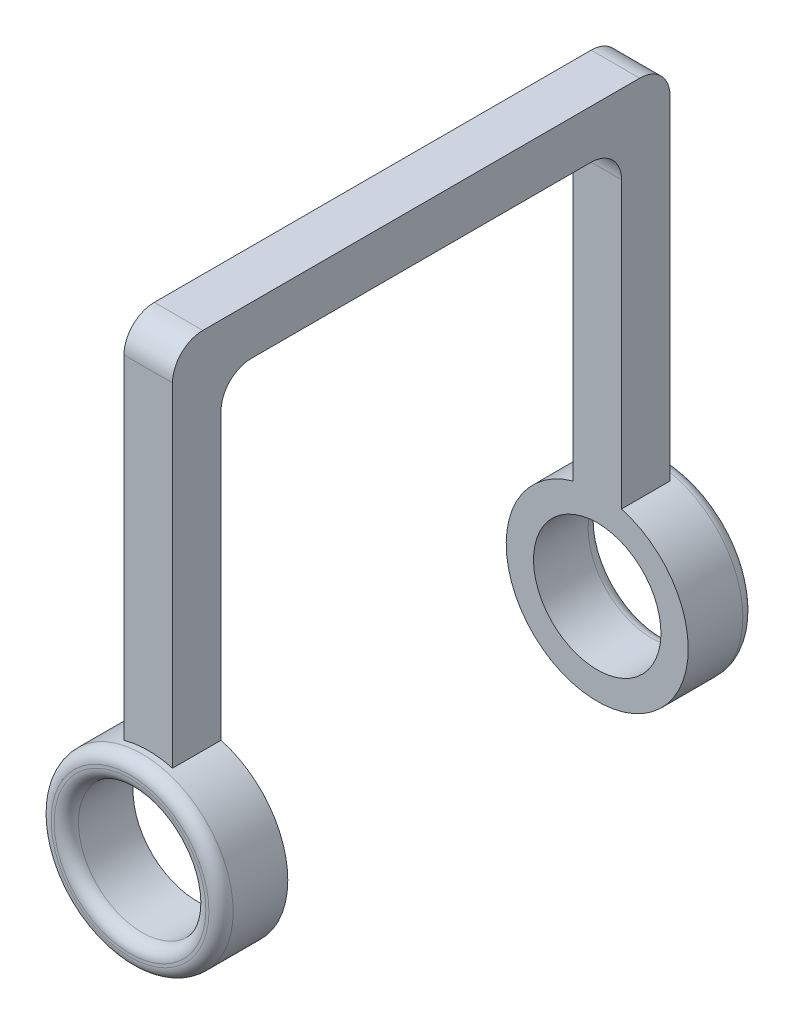
from build123d import *

# Parameters (mm, degrees)
SKETCH1_R               = 10.5
BOSS_EXTRUDE1_DEPTH     = 82
BOSS_EXTRUDE2_START     = 3
SKETCH1_3_R             = 10.5
BOSS_EXTRUDE2_DEPTH     = 3
CUT_EXTRUDE1_DEPTH      = 115.585426104
CUT_EXTRUDE1_DEPTH_BACK = 115.585426104
SKETCH2_W               = 66
SKETCH2_H               = 93.23561667
FILLET1_R               = 5
FILLET2_R               = 2


with BuildPart() as part:
    # Sketch1 → Boss-Extrude1 (new body)
    # profile 1 of 3: a face of its own
    with BuildSketch(Plane.XY):
        with BuildLine():
            Line((4, 14.456832295), (-4, 14.456832295))
            ThreePointArc((-4, 14.456832295), (-9.082951062, -11.937336386), (15, 0))
            ThreePointArc((15, 0), (11.937336386, 9.082951062), (4, 14.456832295))
        make_face()
        Circle(SKETCH1_R, mode=Mode.SUBTRACT)
    # profile 2 of 3: a face of its own
    with BuildSketch(Plane.XY):
        with BuildLine():
            Line((-4, 74.456832295), (-4, 14.456832295))
            ThreePointArc((-4, 14.456832295), (0, 15), (4, 14.456832295))
            Line((4, 14.456832295), (4, 74.456832295))
            Line((4, 74.456832295), (-4, 74.456832295))
        make_face()
    # profile 3 of 3: a face of its own
    with BuildSketch(Plane.XY):
        with BuildLine():
            ThreePointArc((4, 14.456832295), (0, 15), (-4, 14.456832295))
            Line((-4, 14.456832295), (4, 14.456832295))
        make_face()
    extrude(amount=-BOSS_EXTRUDE1_DEPTH)

    # Sketch1<3> → Boss-Extrude2 (add)
    # profile 1 of 2: a face of its own
    with BuildSketch(Plane.XY.offset(BOSS_EXTRUDE2_START)):
        with BuildLine():
            Line((4, 14.456832295), (-4, 14.456832295))
            ThreePointArc((-4, 14.456832295), (-9.082951062, -11.937336386), (15, 0))
            ThreePointArc((15, 0), (11.937336386, 9.082951062), (4, 14.456832295))
        make_face()
        Circle(SKETCH1_3_R, mode=Mode.SUBTRACT)
    # profile 2 of 2: a face of its own
    with BuildSketch(Plane.XY.offset(BOSS_EXTRUDE2_START)):
        with BuildLine():
            ThreePointArc((4, 14.456832295), (0, 15), (-4, 14.456832295))
            Line((-4, 14.456832295), (4, 14.456832295))
        make_face()
    boss_extrude2 = extrude(amount=-BOSS_EXTRUDE2_DEPTH)

    # Mirror1: Boss-Extrude2 across plane
    add(boss_extrude2.mirror(Plane.XY.offset(-41)))

    # Sketch2 → Cut-Extrude1 (cut, two sides: drawn at the far end of the back side and taken through both)
    with BuildSketch(Plane.ZY.offset(4).offset(-CUT_EXTRUDE1_DEPTH_BACK)):
        with Locations((-41, 19.83902396)):
            Rectangle(SKETCH2_W, SKETCH2_H)
    extrude(amount=CUT_EXTRUDE1_DEPTH + CUT_EXTRUDE1_DEPTH_BACK, mode=Mode.SUBTRACT)

    # Fillet1
    fillet1_edges = [part.edges().sort_by_distance(p)[0] for p in [
        (0, 74.456832295, -82),
        (0, 66.456832295, -8),
        (0, 66.456832295, -74),
        (0, 74.456832295, 0),
    ]]
    fillet(fillet1_edges, radius=FILLET1_R)

    # Fillet2
    fillet2_edges = [part.edges().sort_by_distance(p)[0] for p in [
        (-10.5, 0, 3),
        (-4, -14.456832295, 3),
        (-4, -14.456832295, -85),
        (-10.5, 0, -85),
    ]]
    fillet(fillet2_edges, radius=FILLET2_R)


solid = part.part
